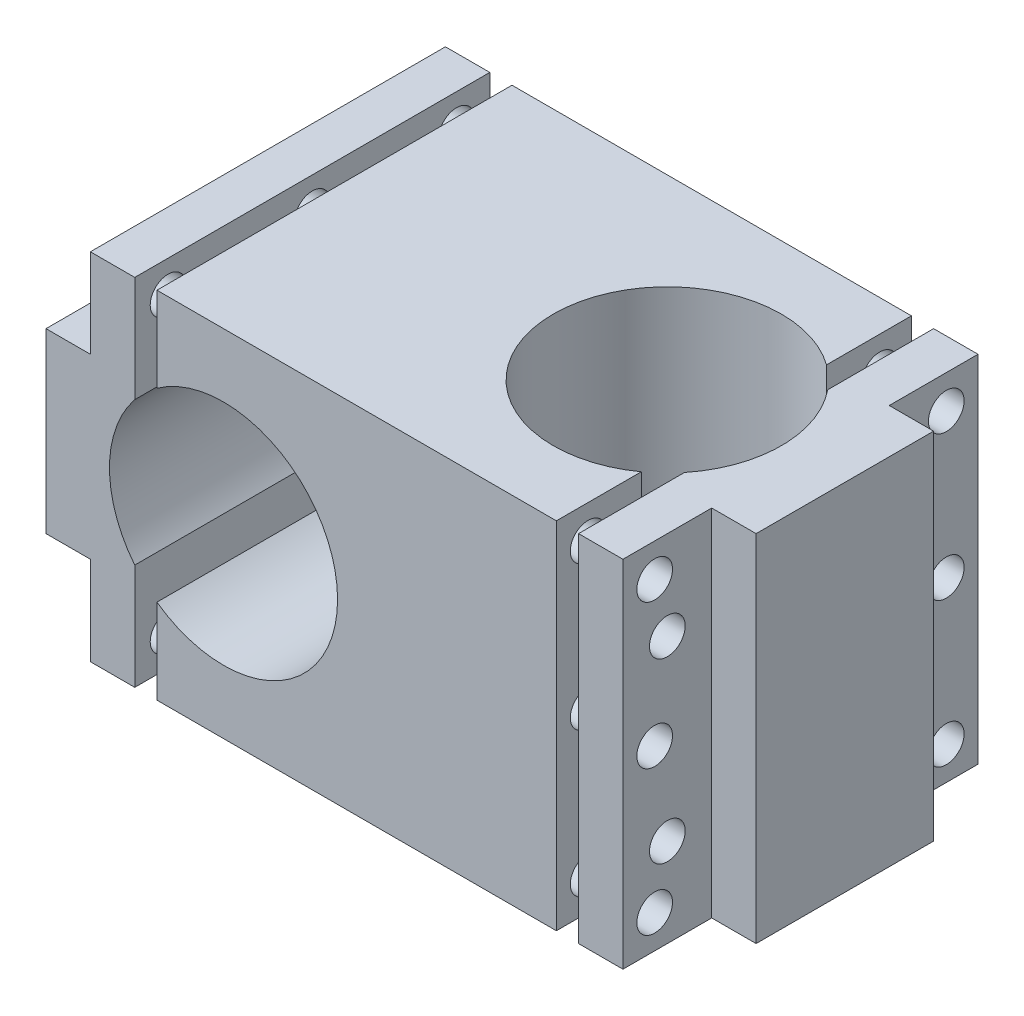
from build123d import *

# Parameters (mm, degrees)
SKETCH1_W                        = 88.9
SKETCH1_H                        = 50.8
BOSS_EXTRUDE1_DEPTH              = 25.4
CUT_EXTRUDE1_REACH               = 74.122
SKETCH2_R                        = 16.3195
SKETCH3_W                        = 3.175
SKETCH3_H                        = 53.695199427
CUT_EXTRUDE4_DEPTH               = 50.8
F_1_4_20_TAPPED_HOLE1_AT_2_COUNT = 2
F_1_4_20_TAPPED_HOLE1_AT_2_PITCH = 41.275
F_1_4_20_TAPPED_HOLE1_AT_3_COUNT = 2
F_1_4_20_TAPPED_HOLE1_AT_3_PITCH = 20.6375
SKETCH7_R                        = 16.3195
CUT_EXTRUDE5_DEPTH               = 50.8
SKETCH8_W                        = 3.175
SKETCH8_H                        = 56.745553367
CUT_EXTRUDE6_DEPTH               = 50.8
F_1_4_20_TAPPED_HOLE2_AT_2_COUNT = 2
F_1_4_20_TAPPED_HOLE2_AT_2_PITCH = 41.275
F_1_4_20_TAPPED_HOLE2_AT_3_COUNT = 2
F_1_4_20_TAPPED_HOLE2_AT_3_PITCH = 20.6375
F_1_4_20_TAPPED_HOLE4_AT_2_COUNT = 2
F_1_4_20_TAPPED_HOLE4_AT_2_PITCH = 25.4
F_1_4_20_TAPPED_HOLE4_AT_3_COUNT = 2
F_1_4_20_TAPPED_HOLE4_AT_3_PITCH = 12.828296655
F_1_4_20_TAPPED_HOLE4_AT_4_COUNT = 2
F_1_4_20_TAPPED_HOLE4_AT_4_PITCH = 8.141197781
F_1_4_20_TAPPED_HOLE4_AT_5_COUNT = 2
F_1_4_20_TAPPED_HOLE4_AT_5_PITCH = 33.386585649
F_1_4_20_TAPPED_HOLE5_AT_2_COUNT = 2
F_1_4_20_TAPPED_HOLE5_AT_2_PITCH = 12.828296655
F_1_4_20_TAPPED_HOLE5_AT_3_COUNT = 2
F_1_4_20_TAPPED_HOLE5_AT_3_PITCH = 20.6375
F_1_4_20_TAPPED_HOLE5_AT_4_COUNT = 2
F_1_4_20_TAPPED_HOLE5_AT_4_PITCH = 12.828296655
F_1_4_20_TAPPED_HOLE5_AT_5_COUNT = 2
F_1_4_20_TAPPED_HOLE5_AT_5_PITCH = 20.6375
SKETCH29_W                       = 50.8
SKETCH29_H                       = 12.7
CUT_EXTRUDE7_DEPTH               = 6.35
SKETCH30_W                       = 12.7
SKETCH30_H                       = 50.8
CUT_EXTRUDE8_DEPTH               = 6.35


with BuildPart() as part:
    # Sketch1 → Boss-Extrude1 (new, symmetric)
    with BuildSketch(Plane(origin=(0, 0, 0), x_dir=(1, 0, 0), z_dir=(0, 1, 0))):
        Rectangle(SKETCH1_W, SKETCH1_H)
    extrude(amount=BOSS_EXTRUDE1_DEPTH, both=True)

    # Sketch2 → Cut-Extrude1 (cut, up to next)
    with BuildSketch(Plane(origin=(0, 25.4, 0), x_dir=(1, 0, 0), z_dir=(0, 1, 0)), mode=Mode.PRIVATE) as cut_extrude1_sk1:
        with Locations(Location((19.05, 0, 0), (0, 0, 270))):
            Circle(SKETCH2_R)
    cut_extrude1_tool1 = extrude(cut_extrude1_sk1.sketch, amount=-CUT_EXTRUDE1_REACH, mode=Mode.PRIVATE) & part.part
    add(cut_extrude1_tool1.solids().sort_by_distance((19.05, 25.4, 0))[0], mode=Mode.SUBTRACT)

    # Sketch3 → Cut-Extrude4 (cut)
    with BuildSketch(Plane(origin=(0, 25.4, 0), x_dir=(1, 0, 0), z_dir=(0, 1, 0))):
        with Locations((30.1625, -1.447599713)):
            Rectangle(SKETCH3_W, SKETCH3_H)
    extrude(amount=-CUT_EXTRUDE4_DEPTH, mode=Mode.SUBTRACT)


with BuildPart() as cut_extrude4_piece_1:
    # of the separate pieces the step leaves, piece 1, a body of its own (cut_extrude4_pieces)
    add(part.part.solids().sort_by_distance((-44.45, 25.4, 25.4))[0])


with BuildPart() as cut_extrude4_piece_2:
    # of the separate pieces the step leaves, piece 2, a body of its own (cut_extrude4_pieces)
    add(part.part.solids().sort_by_distance((31.75, -25.4, 25.4))[0])


with BuildPart() as f_1_4_20_tapped_hole1_tool:
    # Sketch6 → 1/4-20 Tapped Hole1 (revolve)
    with BuildSketch(Plane(origin=(44.45, 20.6375, -20.85975), x_dir=(0, 0, -1), z_dir=(0, 1, 0))):
        Polygon((0, 0), (0, 26.933816902), (2.5527, 25.4), (2.5527, 0), align=None)
    f_1_4_20_tapped_hole1 = revolve(axis=Axis((50.8, 20.6375, -20.85975), (-1, 0, 0)))


with BuildPart() as cut_extrude4_piece_1_1:
    add(cut_extrude4_piece_1.part)

    # 1/4-20 Tapped Hole1: cut by f_1_4_20_tapped_hole1_tool
    add(f_1_4_20_tapped_hole1_tool.part, mode=Mode.SUBTRACT)


with BuildPart() as cut_extrude4_piece_2_1:
    add(cut_extrude4_piece_2.part)

    # 1/4-20 Tapped Hole1: cut by f_1_4_20_tapped_hole1_tool
    add(f_1_4_20_tapped_hole1_tool.part, mode=Mode.SUBTRACT)


with BuildPart() as f_1_4_20_tapped_hole1_at_2_tool:
    # 1/4-20 Tapped Hole1 at 2: 1/4-20 Tapped Hole1 ×2
    with Locations(*[(0, -i * F_1_4_20_TAPPED_HOLE1_AT_2_PITCH, 0) for i in range(1, F_1_4_20_TAPPED_HOLE1_AT_2_COUNT)]):
        add(f_1_4_20_tapped_hole1)


with BuildPart() as cut_extrude4_piece_1_2:
    add(cut_extrude4_piece_1_1.part)

    # 1/4-20 Tapped Hole1 at 2: cut by f_1_4_20_tapped_hole1_at_2_tool
    add(f_1_4_20_tapped_hole1_at_2_tool.part, mode=Mode.SUBTRACT)


with BuildPart() as cut_extrude4_piece_2_2:
    add(cut_extrude4_piece_2_1.part)

    # 1/4-20 Tapped Hole1 at 2: cut by f_1_4_20_tapped_hole1_at_2_tool
    add(f_1_4_20_tapped_hole1_at_2_tool.part, mode=Mode.SUBTRACT)


with BuildPart() as f_1_4_20_tapped_hole1_at_3_tool:
    # 1/4-20 Tapped Hole1 at 3: 1/4-20 Tapped Hole1 ×2
    with Locations(*[(0, -i * F_1_4_20_TAPPED_HOLE1_AT_3_PITCH, 0) for i in range(1, F_1_4_20_TAPPED_HOLE1_AT_3_COUNT)]):
        add(f_1_4_20_tapped_hole1)


with BuildPart() as cut_extrude4_piece_1_3:
    add(cut_extrude4_piece_1_2.part)

    # 1/4-20 Tapped Hole1 at 3: cut by f_1_4_20_tapped_hole1_at_3_tool
    add(f_1_4_20_tapped_hole1_at_3_tool.part, mode=Mode.SUBTRACT)

    # Sketch7 → Cut-Extrude5 (cut)
    with BuildSketch(Plane.XY.offset(25.4)):
        with Locations((-19.05, 0)):
            Circle(SKETCH7_R)
    extrude(amount=-CUT_EXTRUDE5_DEPTH, mode=Mode.SUBTRACT)

    # Sketch8 → Cut-Extrude6 (cut)
    with BuildSketch(Plane.XY.offset(25.4)):
        with Locations((-30.1625, 2.972776683)):
            Rectangle(SKETCH8_W, SKETCH8_H)
    extrude(amount=-CUT_EXTRUDE6_DEPTH, mode=Mode.SUBTRACT)


with BuildPart() as cut_extrude4_piece_2_3:
    add(cut_extrude4_piece_2_2.part)

    # 1/4-20 Tapped Hole1 at 3: cut by f_1_4_20_tapped_hole1_at_3_tool
    add(f_1_4_20_tapped_hole1_at_3_tool.part, mode=Mode.SUBTRACT)


with BuildPart() as cut_extrude6_piece_1:
    # of the separate pieces the step leaves, piece 1, a body of its own (cut_extrude6_pieces)
    add(cut_extrude4_piece_1_3.part.solids().sort_by_distance((-28.575, 25.4, 25.4))[0])


with BuildPart() as cut_extrude6_piece_2:
    # of the separate pieces the step leaves, piece 2, a body of its own (cut_extrude6_pieces)
    add(cut_extrude4_piece_1_3.part.solids().sort_by_distance((-44.45, 25.4, 25.4))[0])


with BuildPart() as f_1_4_20_tapped_hole2_tool:
    # Sketch11 → 1/4-20 Tapped Hole2 (revolve)
    with BuildSketch(Plane(origin=(-44.45, -20.85975, -20.6375), x_dir=(0, 0, 1), z_dir=(0, 1, 0))):
        Polygon((0, 0), (0, 26.933816902), (2.5527, 25.4), (2.5527, 0), align=None)
    f_1_4_20_tapped_hole2 = revolve(axis=Axis((-50.8, -20.85975, -20.6375), (1, 0, 0)))


with BuildPart() as cut_extrude6_piece_1_1:
    add(cut_extrude6_piece_1.part)

    # 1/4-20 Tapped Hole2: cut by f_1_4_20_tapped_hole2_tool
    add(f_1_4_20_tapped_hole2_tool.part, mode=Mode.SUBTRACT)


with BuildPart() as cut_extrude6_piece_2_1:
    add(cut_extrude6_piece_2.part)

    # 1/4-20 Tapped Hole2: cut by f_1_4_20_tapped_hole2_tool
    add(f_1_4_20_tapped_hole2_tool.part, mode=Mode.SUBTRACT)


with BuildPart() as f_1_4_20_tapped_hole2_at_2_tool:
    # 1/4-20 Tapped Hole2 at 2: 1/4-20 Tapped Hole2 ×2
    with Locations(*[(0, 0, i * F_1_4_20_TAPPED_HOLE2_AT_2_PITCH) for i in range(1, F_1_4_20_TAPPED_HOLE2_AT_2_COUNT)]):
        add(f_1_4_20_tapped_hole2)


with BuildPart() as cut_extrude6_piece_1_2:
    add(cut_extrude6_piece_1_1.part)

    # 1/4-20 Tapped Hole2 at 2: cut by f_1_4_20_tapped_hole2_at_2_tool
    add(f_1_4_20_tapped_hole2_at_2_tool.part, mode=Mode.SUBTRACT)


with BuildPart() as cut_extrude6_piece_2_2:
    add(cut_extrude6_piece_2_1.part)

    # 1/4-20 Tapped Hole2 at 2: cut by f_1_4_20_tapped_hole2_at_2_tool
    add(f_1_4_20_tapped_hole2_at_2_tool.part, mode=Mode.SUBTRACT)


with BuildPart() as f_1_4_20_tapped_hole2_at_3_tool:
    # 1/4-20 Tapped Hole2 at 3: 1/4-20 Tapped Hole2 ×2
    with Locations(*[(0, 0, i * F_1_4_20_TAPPED_HOLE2_AT_3_PITCH) for i in range(1, F_1_4_20_TAPPED_HOLE2_AT_3_COUNT)]):
        add(f_1_4_20_tapped_hole2)


with BuildPart() as cut_extrude6_piece_1_3:
    add(cut_extrude6_piece_1_2.part)

    # 1/4-20 Tapped Hole2 at 3: cut by f_1_4_20_tapped_hole2_at_3_tool
    add(f_1_4_20_tapped_hole2_at_3_tool.part, mode=Mode.SUBTRACT)


with BuildPart() as cut_extrude6_piece_2_3:
    add(cut_extrude6_piece_2_2.part)

    # 1/4-20 Tapped Hole2 at 3: cut by f_1_4_20_tapped_hole2_at_3_tool
    add(f_1_4_20_tapped_hole2_at_3_tool.part, mode=Mode.SUBTRACT)


with BuildPart() as f_1_4_20_tapped_hole4_tool:
    # Sketch22 → 1/4-20 Tapped Hole4 (revolve)
    with BuildSketch(Plane(origin=(44.45, 12.7, 19.05), x_dir=(0, 0, -1), z_dir=(0, 1, 0))):
        Polygon((0, 0), (0, 26.933816902), (2.5527, 25.4), (2.5527, 0), align=None)
    f_1_4_20_tapped_hole4 = revolve(axis=Axis((50.8, 12.7, 19.05), (-1, 0, 0)))


with BuildPart() as cut_extrude4_piece_2_4:
    add(cut_extrude4_piece_2_3.part)

    # 1/4-20 Tapped Hole4: cut by f_1_4_20_tapped_hole4_tool
    add(f_1_4_20_tapped_hole4_tool.part, mode=Mode.SUBTRACT)


with BuildPart() as cut_extrude6_piece_1_4:
    add(cut_extrude6_piece_1_3.part)

    # 1/4-20 Tapped Hole4: cut by f_1_4_20_tapped_hole4_tool
    add(f_1_4_20_tapped_hole4_tool.part, mode=Mode.SUBTRACT)


with BuildPart() as f_1_4_20_tapped_hole4_at_2_tool:
    # 1/4-20 Tapped Hole4 at 2: 1/4-20 Tapped Hole4 ×2
    with Locations(*[(0, -i * F_1_4_20_TAPPED_HOLE4_AT_2_PITCH, 0) for i in range(1, F_1_4_20_TAPPED_HOLE4_AT_2_COUNT)]):
        add(f_1_4_20_tapped_hole4)


with BuildPart() as cut_extrude4_piece_2_5:
    add(cut_extrude4_piece_2_4.part)

    # 1/4-20 Tapped Hole4 at 2: cut by f_1_4_20_tapped_hole4_at_2_tool
    add(f_1_4_20_tapped_hole4_at_2_tool.part, mode=Mode.SUBTRACT)


with BuildPart() as cut_extrude6_piece_1_5:
    add(cut_extrude6_piece_1_4.part)

    # 1/4-20 Tapped Hole4 at 2: cut by f_1_4_20_tapped_hole4_at_2_tool
    add(f_1_4_20_tapped_hole4_at_2_tool.part, mode=Mode.SUBTRACT)


with BuildPart() as f_1_4_20_tapped_hole4_at_3_tool:
    # 1/4-20 Tapped Hole4 at 3: 1/4-20 Tapped Hole4 ×2
    with Locations(*[Vector(0, -0.9899989329673501, 0.1410748479478475) * (i * F_1_4_20_TAPPED_HOLE4_AT_3_PITCH) for i in range(1, F_1_4_20_TAPPED_HOLE4_AT_3_COUNT)]):
        add(f_1_4_20_tapped_hole4)


with BuildPart() as cut_extrude4_piece_2_6:
    add(cut_extrude4_piece_2_5.part)

    # 1/4-20 Tapped Hole4 at 3: cut by f_1_4_20_tapped_hole4_at_3_tool
    add(f_1_4_20_tapped_hole4_at_3_tool.part, mode=Mode.SUBTRACT)


with BuildPart() as cut_extrude6_piece_1_6:
    add(cut_extrude6_piece_1_5.part)

    # 1/4-20 Tapped Hole4 at 3: cut by f_1_4_20_tapped_hole4_at_3_tool
    add(f_1_4_20_tapped_hole4_at_3_tool.part, mode=Mode.SUBTRACT)


with BuildPart() as f_1_4_20_tapped_hole4_at_4_tool:
    # 1/4-20 Tapped Hole4 at 4: 1/4-20 Tapped Hole4 ×2
    with Locations(*[Vector(0, 0.9749793842788765, 0.2222952996155853) * (i * F_1_4_20_TAPPED_HOLE4_AT_4_PITCH) for i in range(1, F_1_4_20_TAPPED_HOLE4_AT_4_COUNT)]):
        add(f_1_4_20_tapped_hole4)


with BuildPart() as cut_extrude4_piece_2_7:
    add(cut_extrude4_piece_2_6.part)

    # 1/4-20 Tapped Hole4 at 4: cut by f_1_4_20_tapped_hole4_at_4_tool
    add(f_1_4_20_tapped_hole4_at_4_tool.part, mode=Mode.SUBTRACT)


with BuildPart() as cut_extrude6_piece_1_7:
    add(cut_extrude6_piece_1_6.part)

    # 1/4-20 Tapped Hole4 at 4: cut by f_1_4_20_tapped_hole4_at_4_tool
    add(f_1_4_20_tapped_hole4_at_4_tool.part, mode=Mode.SUBTRACT)


with BuildPart() as f_1_4_20_tapped_hole4_at_5_tool:
    # 1/4-20 Tapped Hole4 at 5: 1/4-20 Tapped Hole4 ×2
    with Locations(*[Vector(0, -0.9985297793032001, 0.054205902305030786) * (i * F_1_4_20_TAPPED_HOLE4_AT_5_PITCH) for i in range(1, F_1_4_20_TAPPED_HOLE4_AT_5_COUNT)]):
        add(f_1_4_20_tapped_hole4)


with BuildPart() as cut_extrude4_piece_2_8:
    add(cut_extrude4_piece_2_7.part)

    # 1/4-20 Tapped Hole4 at 5: cut by f_1_4_20_tapped_hole4_at_5_tool
    add(f_1_4_20_tapped_hole4_at_5_tool.part, mode=Mode.SUBTRACT)

    # Sketch30 → Cut-Extrude8 (cut)
    with BuildSketch(Plane(origin=(44.45, 0, 0), x_dir=(0, 0, -1), z_dir=(1, 0, 0))):
        with Locations((-19.05, 0)):
            Rectangle(SKETCH30_W, SKETCH30_H)
    cut_extrude8 = extrude(amount=-CUT_EXTRUDE8_DEPTH, mode=Mode.SUBTRACT)

    # Mirror2: Cut-Extrude8 across plane
    add(cut_extrude8.mirror(Plane.XY), mode=Mode.SUBTRACT)


with BuildPart() as cut_extrude6_piece_1_8:
    add(cut_extrude6_piece_1_7.part)

    # 1/4-20 Tapped Hole4 at 5: cut by f_1_4_20_tapped_hole4_at_5_tool
    add(f_1_4_20_tapped_hole4_at_5_tool.part, mode=Mode.SUBTRACT)


with BuildPart() as f_1_4_20_tapped_hole5_tool:
    # Sketch28 → 1/4-20 Tapped Hole5 (revolve)
    with BuildSketch(Plane(origin=(-44.45, 20.85975, 0), x_dir=(0, 0, 1), z_dir=(0, 1, 0))):
        Polygon((0, 0), (0, 26.933816902), (2.5527, 25.4), (2.5527, 0), align=None)
    f_1_4_20_tapped_hole5 = revolve(axis=Axis((-50.8, 20.85975, 0), (1, 0, 0)))


with BuildPart() as cut_extrude6_piece_1_9:
    add(cut_extrude6_piece_1_8.part)

    # 1/4-20 Tapped Hole5: cut by f_1_4_20_tapped_hole5_tool
    add(f_1_4_20_tapped_hole5_tool.part, mode=Mode.SUBTRACT)


with BuildPart() as cut_extrude6_piece_2_4:
    add(cut_extrude6_piece_2_3.part)

    # 1/4-20 Tapped Hole5: cut by f_1_4_20_tapped_hole5_tool
    add(f_1_4_20_tapped_hole5_tool.part, mode=Mode.SUBTRACT)


with BuildPart() as f_1_4_20_tapped_hole5_at_2_tool:
    # 1/4-20 Tapped Hole5 at 2: 1/4-20 Tapped Hole5 ×2
    with Locations(*[Vector(0, -0.1410748479478475, -0.9899989329673501) * (i * F_1_4_20_TAPPED_HOLE5_AT_2_PITCH) for i in range(1, F_1_4_20_TAPPED_HOLE5_AT_2_COUNT)]):
        add(f_1_4_20_tapped_hole5)


with BuildPart() as cut_extrude6_piece_1_10:
    add(cut_extrude6_piece_1_9.part)

    # 1/4-20 Tapped Hole5 at 2: cut by f_1_4_20_tapped_hole5_at_2_tool
    add(f_1_4_20_tapped_hole5_at_2_tool.part, mode=Mode.SUBTRACT)


with BuildPart() as cut_extrude6_piece_2_5:
    add(cut_extrude6_piece_2_4.part)

    # 1/4-20 Tapped Hole5 at 2: cut by f_1_4_20_tapped_hole5_at_2_tool
    add(f_1_4_20_tapped_hole5_at_2_tool.part, mode=Mode.SUBTRACT)


with BuildPart() as f_1_4_20_tapped_hole5_at_3_tool:
    # 1/4-20 Tapped Hole5 at 3: 1/4-20 Tapped Hole5 ×2
    with Locations(*[(0, 0, -i * F_1_4_20_TAPPED_HOLE5_AT_3_PITCH) for i in range(1, F_1_4_20_TAPPED_HOLE5_AT_3_COUNT)]):
        add(f_1_4_20_tapped_hole5)


with BuildPart() as cut_extrude6_piece_1_11:
    add(cut_extrude6_piece_1_10.part)

    # 1/4-20 Tapped Hole5 at 3: cut by f_1_4_20_tapped_hole5_at_3_tool
    add(f_1_4_20_tapped_hole5_at_3_tool.part, mode=Mode.SUBTRACT)


with BuildPart() as cut_extrude6_piece_2_6:
    add(cut_extrude6_piece_2_5.part)

    # 1/4-20 Tapped Hole5 at 3: cut by f_1_4_20_tapped_hole5_at_3_tool
    add(f_1_4_20_tapped_hole5_at_3_tool.part, mode=Mode.SUBTRACT)


with BuildPart() as f_1_4_20_tapped_hole5_at_4_tool:
    # 1/4-20 Tapped Hole5 at 4: 1/4-20 Tapped Hole5 ×2
    with Locations(*[Vector(0, -0.1410748479478475, 0.9899989329673501) * (i * F_1_4_20_TAPPED_HOLE5_AT_4_PITCH) for i in range(1, F_1_4_20_TAPPED_HOLE5_AT_4_COUNT)]):
        add(f_1_4_20_tapped_hole5)


with BuildPart() as cut_extrude6_piece_1_12:
    add(cut_extrude6_piece_1_11.part)

    # 1/4-20 Tapped Hole5 at 4: cut by f_1_4_20_tapped_hole5_at_4_tool
    add(f_1_4_20_tapped_hole5_at_4_tool.part, mode=Mode.SUBTRACT)


with BuildPart() as cut_extrude6_piece_2_7:
    add(cut_extrude6_piece_2_6.part)

    # 1/4-20 Tapped Hole5 at 4: cut by f_1_4_20_tapped_hole5_at_4_tool
    add(f_1_4_20_tapped_hole5_at_4_tool.part, mode=Mode.SUBTRACT)


with BuildPart() as f_1_4_20_tapped_hole5_at_5_tool:
    # 1/4-20 Tapped Hole5 at 5: 1/4-20 Tapped Hole5 ×2
    with Locations(*[(0, 0, i * F_1_4_20_TAPPED_HOLE5_AT_5_PITCH) for i in range(1, F_1_4_20_TAPPED_HOLE5_AT_5_COUNT)]):
        add(f_1_4_20_tapped_hole5)


with BuildPart() as cut_extrude6_piece_1_13:
    add(cut_extrude6_piece_1_12.part)

    # 1/4-20 Tapped Hole5 at 5: cut by f_1_4_20_tapped_hole5_at_5_tool
    add(f_1_4_20_tapped_hole5_at_5_tool.part, mode=Mode.SUBTRACT)


with BuildPart() as cut_extrude6_piece_2_8:
    add(cut_extrude6_piece_2_7.part)

    # 1/4-20 Tapped Hole5 at 5: cut by f_1_4_20_tapped_hole5_at_5_tool
    add(f_1_4_20_tapped_hole5_at_5_tool.part, mode=Mode.SUBTRACT)

    # Sketch29 → Cut-Extrude7 (cut)
    with BuildSketch(Plane.ZY.offset(44.45)):
        with Locations((0, 19.05)):
            Rectangle(SKETCH29_W, SKETCH29_H)
    cut_extrude7 = extrude(amount=-CUT_EXTRUDE7_DEPTH, mode=Mode.SUBTRACT)

    # Mirror1: Cut-Extrude7 across plane
    add(cut_extrude7.mirror(Plane.ZX), mode=Mode.SUBTRACT)


solid = Compound([cut_extrude4_piece_2_8.part, cut_extrude6_piece_1_13.part, cut_extrude6_piece_2_8.part])
